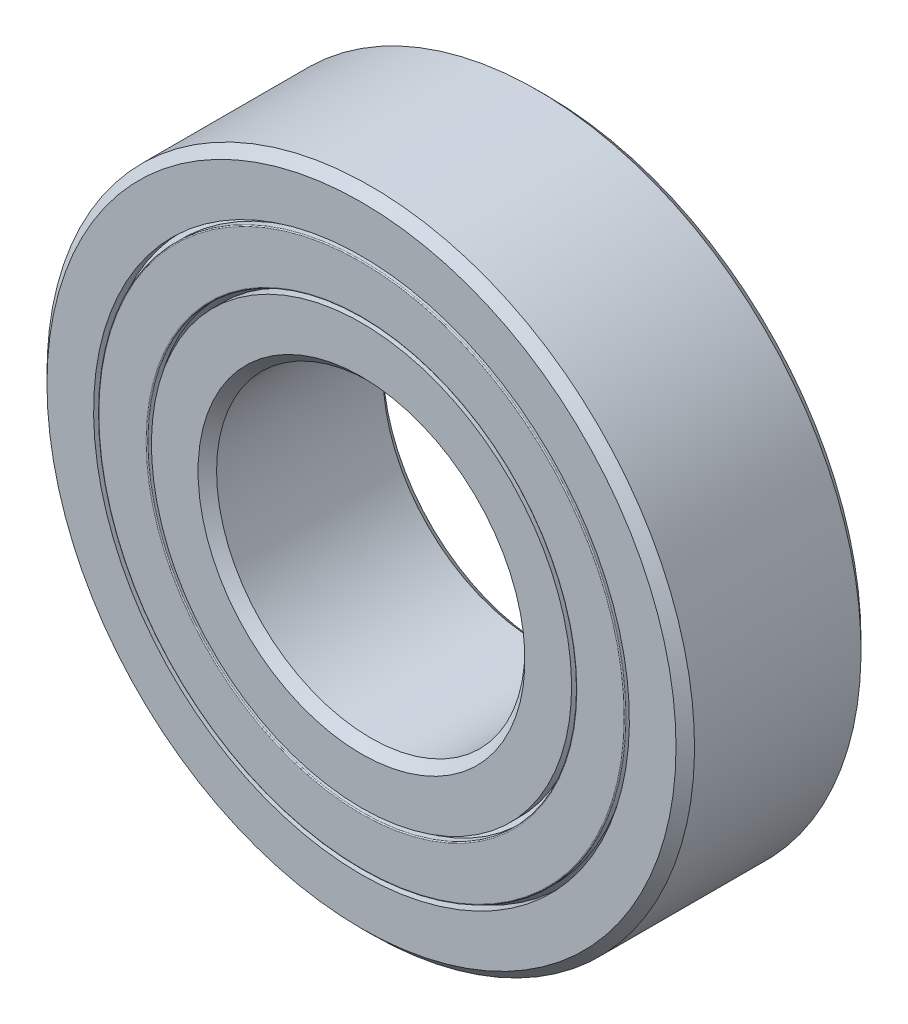
from build123d import *

# Parameters (mm, degrees)
CIRPATTERN1_COUNT   = 9
SKETCH7_R           = 16.4375
SKETCH7_R_2         = 15.5
BOSS_EXTRUDE1_DEPTH = 1
FILLET1_R           = 0.066666667
FILLET2_R           = 0.066666667


with BuildPart() as part:
    # Sketch3 → Revolve1 (revolve)
    with BuildSketch(Plane(origin=(0, 0, 0), x_dir=(0, 0, -1), z_dir=(1, 0, 0)), mode=Mode.PRIVATE) as revolve1_sk:
        with BuildLine():
            Line((5.4, 21), (6, 20.4))
            Line((6, 20.4), (6, 17.375))
            Line((6, 17.375), (2.666666667, 17.375))
            ThreePointArc((2.666666667, 17.375), (0, 18.759867499), (-2.666666667, 17.375))
            Line((-2.666666667, 17.375), (-6, 17.375))
            Line((-6, 17.375), (-6, 20.4))
            Line((-6, 20.4), (-5.4, 21))
            Line((-5.4, 21), (5.4, 21))
        make_face()
    revolve(revolve1_sk.sketch.rotate(Axis((0, 0, 6), (0, 0, -1)), 180), axis=Axis((0, 0, 6), (0, 0, -1)))


with BuildPart() as body_2:
    # Sketch4 → Revolve2 (revolve)
    with BuildSketch(Plane(origin=(0, 0, 0), x_dir=(0, 0, -1), z_dir=(1, 0, 0)), mode=Mode.PRIVATE) as revolve2_sk:
        with BuildLine():
            Line((-5.4, 10), (-6, 10.6))
            Line((-6, 10.6), (-6, 13.625))
            Line((-6, 13.625), (-2.666666667, 13.625))
            ThreePointArc((-2.666666667, 13.625), (0, 12.240132501), (2.666666667, 13.625))
            Line((2.666666667, 13.625), (6, 13.625))
            Line((6, 13.625), (6, 10.6))
            Line((6, 10.6), (5.4, 10))
            Line((5.4, 10), (-5.4, 10))
        make_face()
    revolve(revolve2_sk.sketch.rotate(Axis((0, 0, 6), (0, 0, -1)), 180), axis=Axis((0, 0, 6), (0, 0, -1)))


with BuildPart() as body_3:
    # Sketch5 → Revolve3 (revolve)
    with BuildSketch(Plane(origin=(0, 0, 0), x_dir=(0, 0, -1), z_dir=(1, 0, 0))):
        with BuildLine():
            Line((-3.259867499, 15.5), (3.259867499, 15.5))
            ThreePointArc((3.259867499, 15.5), (0, 18.759867499), (-3.259867499, 15.5))
        make_face()
    revolve(axis=Axis((0, 15.5, 3.259867499), (0, 0, -1)))


with BuildPart() as body_4:
    # Sketch6 → Revolve4 (revolve)
    with BuildSketch(Plane(origin=(0, 0, 0), x_dir=(0, 0, -1), z_dir=(1, 0, 0))):
        with BuildLine():
            Line((-3.12215148, 16.4375), (-3.6017929, 16.4375))
            ThreePointArc((-3.6017929, 16.4375), (-3.84161361, 15.5), (-3.6017929, 14.5625))
            Line((-3.6017929, 14.5625), (-3.12215148, 14.5625))
            ThreePointArc((-3.12215148, 14.5625), (-3.259867499, 15.5), (-3.12215148, 16.4375))
        make_face()
    revolve(axis=Axis((0, 21, 0), (0, -1, 0)))


with BuildPart() as cirpattern1_1:
    # CirPattern1: pattern copy
    add(body_4.part.rotate(Axis((0, 0, 0), (0, 0, 1)), 1 * 360 / CIRPATTERN1_COUNT))


with BuildPart() as cirpattern1_2:
    # CirPattern1: pattern copy
    add(body_4.part.rotate(Axis((0, 0, 0), (0, 0, 1)), 2 * 360 / CIRPATTERN1_COUNT))


with BuildPart() as cirpattern1_3:
    # CirPattern1: pattern copy
    add(body_4.part.rotate(Axis((0, 0, 0), (0, 0, 1)), 3 * 360 / CIRPATTERN1_COUNT))


with BuildPart() as cirpattern1_4:
    # CirPattern1: pattern copy
    add(body_4.part.rotate(Axis((0, 0, 0), (0, 0, 1)), 4 * 360 / CIRPATTERN1_COUNT))


with BuildPart() as cirpattern1_5:
    # CirPattern1: pattern copy
    add(body_4.part.rotate(Axis((0, 0, 0), (0, 0, 1)), 5 * 360 / CIRPATTERN1_COUNT))


with BuildPart() as cirpattern1_6:
    # CirPattern1: pattern copy
    add(body_4.part.rotate(Axis((0, 0, 0), (0, 0, 1)), 6 * 360 / CIRPATTERN1_COUNT))


with BuildPart() as cirpattern1_7:
    # CirPattern1: pattern copy
    add(body_4.part.rotate(Axis((0, 0, 0), (0, 0, 1)), 7 * 360 / CIRPATTERN1_COUNT))


with BuildPart() as cirpattern1_8:
    # CirPattern1: pattern copy
    add(body_4.part.rotate(Axis((0, 0, 0), (0, 0, 1)), 8 * 360 / CIRPATTERN1_COUNT))


with BuildPart() as cirpattern1_9:
    # CirPattern1: pattern copy
    add(body_3.part.rotate(Axis((0, 0, 0), (0, 0, 1)), 1 * 360 / CIRPATTERN1_COUNT))


with BuildPart() as cirpattern1_10:
    # CirPattern1: pattern copy
    add(body_3.part.rotate(Axis((0, 0, 0), (0, 0, 1)), 2 * 360 / CIRPATTERN1_COUNT))


with BuildPart() as cirpattern1_11:
    # CirPattern1: pattern copy
    add(body_3.part.rotate(Axis((0, 0, 0), (0, 0, 1)), 3 * 360 / CIRPATTERN1_COUNT))


with BuildPart() as cirpattern1_12:
    # CirPattern1: pattern copy
    add(body_3.part.rotate(Axis((0, 0, 0), (0, 0, 1)), 4 * 360 / CIRPATTERN1_COUNT))


with BuildPart() as cirpattern1_13:
    # CirPattern1: pattern copy
    add(body_3.part.rotate(Axis((0, 0, 0), (0, 0, 1)), 5 * 360 / CIRPATTERN1_COUNT))


with BuildPart() as cirpattern1_14:
    # CirPattern1: pattern copy
    add(body_3.part.rotate(Axis((0, 0, 0), (0, 0, 1)), 6 * 360 / CIRPATTERN1_COUNT))


with BuildPart() as cirpattern1_15:
    # CirPattern1: pattern copy
    add(body_3.part.rotate(Axis((0, 0, 0), (0, 0, 1)), 7 * 360 / CIRPATTERN1_COUNT))


with BuildPart() as cirpattern1_16:
    # CirPattern1: pattern copy
    add(body_3.part.rotate(Axis((0, 0, 0), (0, 0, 1)), 8 * 360 / CIRPATTERN1_COUNT))


with BuildPart() as body_21:
    # Sketch7 → Boss-Extrude1 (new, symmetric)
    with BuildSketch(Plane.XY):
        Circle(SKETCH7_R)
        Circle(SKETCH7_R_2, mode=Mode.SUBTRACT)
    extrude(amount=BOSS_EXTRUDE1_DEPTH, both=True)


with BuildPart() as body_22:
    # Sketch8 → Revolve5 (revolve)
    with BuildSketch(Plane(origin=(0, 0, 0), x_dir=(0, 0, -1), z_dir=(1, 0, 0)), mode=Mode.PRIVATE) as revolve5_sk:
        Polygon((-6, 17.09375), (-5.555555556, 17.09375), (-5.333333333, 17.375), (-5.333333333, 17.09375), (-5.333333333, 13.90625), (-5.333333333, 13.625), (-5.555555556, 13.90625), (-6, 13.90625), align=None)
        Polygon((6, 17.09375), (6, 13.90625), (5.555555556, 13.90625), (5.333333333, 13.625), (5.333333333, 13.90625), (5.333333333, 17.09375), (5.333333333, 17.375), (5.555555556, 17.09375), align=None)
    revolve(revolve5_sk.sketch.rotate(Axis((0, 0, 6), (0, 0, -1)), 180), axis=Axis((0, 0, 6), (0, 0, -1)))

    # Fillet1
    fillet1_edges = [body_22.edges().sort_by_distance(p)[0] for p in [
        (0, 17.09375, 6),
        (0, 13.90625, 6),
    ]]
    fillet(fillet1_edges, radius=FILLET1_R)

    # Fillet2
    fillet2_edges = [body_22.edges().sort_by_distance(p)[0] for p in [
        (0, 17.09375, -6),
        (0, 13.90625, -6),
    ]]
    fillet(fillet2_edges, radius=FILLET2_R)


solid = Compound([part.part, body_2.part, body_3.part, body_4.part, cirpattern1_1.part, cirpattern1_2.part, cirpattern1_3.part, cirpattern1_4.part, cirpattern1_5.part, cirpattern1_6.part, cirpattern1_7.part, cirpattern1_8.part, cirpattern1_9.part, cirpattern1_10.part, cirpattern1_11.part, cirpattern1_12.part, cirpattern1_13.part, cirpattern1_14.part, cirpattern1_15.part, cirpattern1_16.part, body_21.part, body_22.part])
